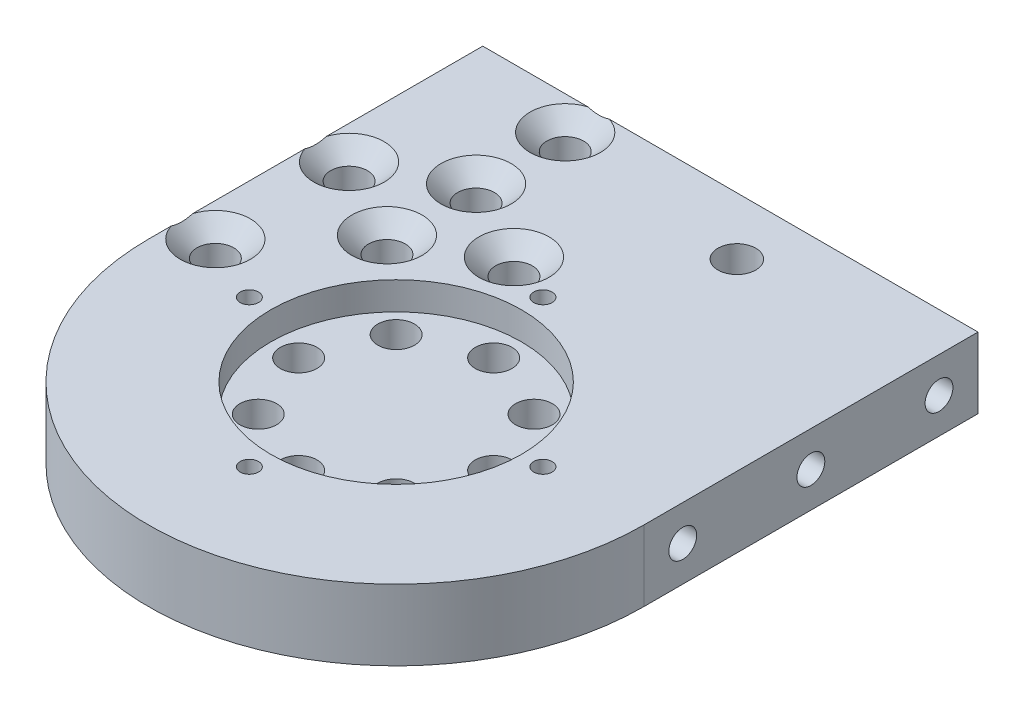
from build123d import *

# Parameters (mm, degrees)
EXTRUDE_1_DEPTH               = 12.7
SKETCH_2_R                    = 22.5
CUT_EXTRUDE_1_DEPTH           = 5
SKETCH_3_R                    = 3.3
CUT_EXTRUDE_2_DEPTH           = 138.376499082
SKETCH_4_R                    = 1.65
CUT_EXTRUDE_3_DEPTH           = 138.747241352
SKETCH_5_R                    = 3.3
CUT_EXTRUDE_4_DEPTH           = 138.747241352
SKETCH_6_R                    = 6.3
CUT_EXTRUDE_5_DEPTH           = 3
CUT_EXTRUDE_5_DRAFT           = -45
CUT_EXTRUDE_5_PROFILE_2_DEPTH = 3
CUT_EXTRUDE_5_PROFILE_2_DRAFT = -45
CUT_EXTRUDE_5_PROFILE_3_DEPTH = 3
CUT_EXTRUDE_5_PROFILE_3_DRAFT = -45
SKETCH_7_R                    = 3.3
CUT_EXTRUDE_6_DEPTH           = 138.747241352
SKETCH_8_R                    = 6.3
CUT_EXTRUDE_7_DEPTH           = 3
CUT_EXTRUDE_7_DRAFT           = -45
CUT_EXTRUDE_7_PROFILE_2_DEPTH = 3
CUT_EXTRUDE_7_PROFILE_2_DRAFT = -45
SKETCH_9_R                    = 3.3
CUT_EXTRUDE_8_DEPTH           = 138.747241352
SKETCH_10_R                   = 6.3
CUT_EXTRUDE_9_DEPTH           = 3
CUT_EXTRUDE_9_DRAFT           = -45
SKETCH_11_R                   = 3.4
CUT_EXTRUDE_10_DEPTH          = 138.747241352
SKETCH_12_R                   = 2.5
CUT_EXTRUDE_11_DEPTH          = 10
SKETCH_13_R                   = 2.5
CUT_EXTRUDE_12_DEPTH          = 15


with BuildPart() as part:
    # 草图1 → 凸台-拉伸1 (new body)
    with BuildSketch(Plane(origin=(0, 0, 0), x_dir=(1, 0, 0), z_dir=(0, 1, 0))):
        with BuildLine():
            Line((0, 0), (88.9, 0))
            Line((88.9, 0), (88.9, -60))
            ThreePointArc((88.9, -60), (44.45, -104.45), (0, -60))
            Line((0, -60), (0, 0))
        make_face()
    extrude(amount=EXTRUDE_1_DEPTH)

    # 草图2 → 切除-拉伸1 (cut)
    with BuildSketch(Plane(origin=(0, 12.7, 0), x_dir=(1, 0, 0), z_dir=(0, 1, 0))):
        with Locations(Location((44.45, -60, 0), (0, 0, 270))):
            Circle(SKETCH_2_R)
    extrude(amount=-CUT_EXTRUDE_1_DEPTH, mode=Mode.SUBTRACT)

    # 草图3 → 切除-拉伸2 (cut, through all)
    with BuildSketch(Plane(origin=(0, 7.7, 0), x_dir=(1, 0, 0), z_dir=(0, 1, 0))):
        with Locations(Location((44.45, -42.5, 0), (0, 0, 270))):
            Circle(SKETCH_3_R)
        with Locations(Location((56.824368671, -47.625631329, 0), (0, 0, 270))):
            Circle(SKETCH_3_R)
        with Locations(Location((61.95, -60, 0), (0, 0, 270))):
            Circle(SKETCH_3_R)
        with Locations(Location((56.824368671, -72.374368671, 0), (0, 0, 270))):
            Circle(SKETCH_3_R)
        with Locations(Location((44.45, -77.5, 0), (0, 0, 270))):
            Circle(SKETCH_3_R)
        with Locations(Location((32.075631329, -72.374368671, 0), (0, 0, 270))):
            Circle(SKETCH_3_R)
        with Locations(Location((26.95, -60, 0), (0, 0, 270))):
            Circle(SKETCH_3_R)
        with Locations(Location((32.075631329, -47.625631329, 0), (0, 0, 270))):
            Circle(SKETCH_3_R)
    extrude(amount=-CUT_EXTRUDE_2_DEPTH, mode=Mode.SUBTRACT)

    # 草图4 → 切除-拉伸3 (cut, through all)
    with BuildSketch(Plane(origin=(0, 12.7, 0), x_dir=(1, 0, 0), z_dir=(0, 1, 0))):
        with Locations(Location((44.45, -33.65, 0), (0, 0, 270))):
            Circle(SKETCH_4_R)
        with Locations(Location((70.8, -60, 0), (0, 0, 270))):
            Circle(SKETCH_4_R)
        with Locations(Location((44.45, -86.35, 0), (0, 0, 270))):
            Circle(SKETCH_4_R)
        with Locations(Location((18.1, -60, 0), (0, 0, 270))):
            Circle(SKETCH_4_R)
    extrude(amount=-CUT_EXTRUDE_3_DEPTH, mode=Mode.SUBTRACT)

    # 草图5 → 切除-拉伸4 (cut, through all)
    with BuildSketch(Plane(origin=(0, 12.7, 0), x_dir=(1, 0, 0), z_dir=(0, 1, 0))):
        with Locations(Location((20.8, -6, 0), (0, 0, 270))):
            Circle(SKETCH_5_R)
        with Locations(Location((20.8, -22, 0), (0, 0, 270))):
            Circle(SKETCH_5_R)
        with Locations(Location((20.8, -38, 0), (0, 0, 270))):
            Circle(SKETCH_5_R)
    extrude(amount=-CUT_EXTRUDE_4_DEPTH, mode=Mode.SUBTRACT)


with BuildPart() as cut_extrude_5_tool:
    # 草图6 → 切除-拉伸5 (with draft: the straight prism first)
    with BuildSketch(Plane(origin=(0, 12.7, 0), x_dir=(1, 0, 0), z_dir=(0, 1, 0))):
        with Locations((20.8, -6)):
            Circle(SKETCH_6_R)
    extrude(amount=-CUT_EXTRUDE_5_DEPTH)
    # 切除-拉伸5: the draft: its side faces are tilted about the plane it starts from
    cut_extrude_5_sides = [cut_extrude_5_tool.faces().sort_by_distance(p)[0] for p in [
        (14.5, 11.2, 6),
    ]]
    draft(cut_extrude_5_sides, Plane(origin=(0, 12.7, 0), x_dir=(1, 0, 0), z_dir=(0, 1, 0)), CUT_EXTRUDE_5_DRAFT)


with BuildPart() as part_1:
    add(part.part)

    # 切除-拉伸5: cut by cut_extrude_5_tool
    add(cut_extrude_5_tool.part, mode=Mode.SUBTRACT)


with BuildPart() as cut_extrude_5_profile_2_tool:
    # 草图6 → 切除-拉伸5 profile 2 (with draft: the straight prism first)
    with BuildSketch(Plane(origin=(0, 12.7, 0), x_dir=(1, 0, 0), z_dir=(0, 1, 0))):
        with Locations((20.8, -22)):
            Circle(SKETCH_6_R)
    extrude(amount=-CUT_EXTRUDE_5_PROFILE_2_DEPTH)
    # 切除-拉伸5 profile 2: the draft: its side faces are tilted about the plane it starts from
    cut_extrude_5_profile_2_sides = [cut_extrude_5_profile_2_tool.faces().sort_by_distance(p)[0] for p in [
        (14.5, 11.2, 22),
    ]]
    draft(cut_extrude_5_profile_2_sides, Plane(origin=(0, 12.7, 0), x_dir=(1, 0, 0), z_dir=(0, 1, 0)), CUT_EXTRUDE_5_PROFILE_2_DRAFT)


with BuildPart() as part_2:
    add(part_1.part)

    # 切除-拉伸5 profile 2: cut by cut_extrude_5_profile_2_tool
    add(cut_extrude_5_profile_2_tool.part, mode=Mode.SUBTRACT)


with BuildPart() as cut_extrude_5_profile_3_tool:
    # 草图6 → 切除-拉伸5 profile 3 (with draft: the straight prism first)
    with BuildSketch(Plane(origin=(0, 12.7, 0), x_dir=(1, 0, 0), z_dir=(0, 1, 0))):
        with Locations((20.8, -38)):
            Circle(SKETCH_6_R)
    extrude(amount=-CUT_EXTRUDE_5_PROFILE_3_DEPTH)
    # 切除-拉伸5 profile 3: the draft: its side faces are tilted about the plane it starts from
    cut_extrude_5_profile_3_sides = [cut_extrude_5_profile_3_tool.faces().sort_by_distance(p)[0] for p in [
        (14.5, 11.2, 38),
    ]]
    draft(cut_extrude_5_profile_3_sides, Plane(origin=(0, 12.7, 0), x_dir=(1, 0, 0), z_dir=(0, 1, 0)), CUT_EXTRUDE_5_PROFILE_3_DRAFT)


with BuildPart() as part_3:
    add(part_2.part)

    # 切除-拉伸5 profile 3: cut by cut_extrude_5_profile_3_tool
    add(cut_extrude_5_profile_3_tool.part, mode=Mode.SUBTRACT)

    # 草图7 → 切除-拉伸6 (cut, through all)
    with BuildSketch(Plane(origin=(0, 12.7, 0), x_dir=(1, 0, 0), z_dir=(0, 1, 0))):
        with Locations(Location((6, -30, 0), (0, 0, 270))):
            Circle(SKETCH_7_R)
        with Locations(Location((6, -54, 0), (0, 0, 270))):
            Circle(SKETCH_7_R)
    extrude(amount=-CUT_EXTRUDE_6_DEPTH, mode=Mode.SUBTRACT)


with BuildPart() as cut_extrude_7_tool:
    # 草图8 → 切除-拉伸7 (with draft: the straight prism first)
    with BuildSketch(Plane(origin=(0, 12.7, 0), x_dir=(1, 0, 0), z_dir=(0, 1, 0))):
        with Locations((6, -30)):
            Circle(SKETCH_8_R)
    extrude(amount=-CUT_EXTRUDE_7_DEPTH)
    # 切除-拉伸7: the draft: its side faces are tilted about the plane it starts from
    cut_extrude_7_sides = [cut_extrude_7_tool.faces().sort_by_distance(p)[0] for p in [
        (-0.3, 11.2, 30),
    ]]
    draft(cut_extrude_7_sides, Plane(origin=(0, 12.7, 0), x_dir=(1, 0, 0), z_dir=(0, 1, 0)), CUT_EXTRUDE_7_DRAFT)


with BuildPart() as part_4:
    add(part_3.part)

    # 切除-拉伸7: cut by cut_extrude_7_tool
    add(cut_extrude_7_tool.part, mode=Mode.SUBTRACT)


with BuildPart() as cut_extrude_7_profile_2_tool:
    # 草图8 → 切除-拉伸7 profile 2 (with draft: the straight prism first)
    with BuildSketch(Plane(origin=(0, 12.7, 0), x_dir=(1, 0, 0), z_dir=(0, 1, 0))):
        with Locations((6, -54)):
            Circle(SKETCH_8_R)
    extrude(amount=-CUT_EXTRUDE_7_PROFILE_2_DEPTH)
    # 切除-拉伸7 profile 2: the draft: its side faces are tilted about the plane it starts from
    cut_extrude_7_profile_2_sides = [cut_extrude_7_profile_2_tool.faces().sort_by_distance(p)[0] for p in [
        (-0.3, 11.2, 54),
    ]]
    draft(cut_extrude_7_profile_2_sides, Plane(origin=(0, 12.7, 0), x_dir=(1, 0, 0), z_dir=(0, 1, 0)), CUT_EXTRUDE_7_PROFILE_2_DRAFT)


with BuildPart() as part_5:
    add(part_4.part)

    # 切除-拉伸7 profile 2: cut by cut_extrude_7_profile_2_tool
    add(cut_extrude_7_profile_2_tool.part, mode=Mode.SUBTRACT)

    # 草图9 → 切除-拉伸8 (cut, through all)
    with BuildSketch(Plane(origin=(0, 12.7, 0), x_dir=(1, 0, 0), z_dir=(0, 1, 0))):
        with Locations(Location((35.6, -30, 0), (0, 0, 270))):
            Circle(SKETCH_9_R)
    extrude(amount=-CUT_EXTRUDE_8_DEPTH, mode=Mode.SUBTRACT)


with BuildPart() as cut_extrude_9_tool:
    # 草图10 → 切除-拉伸9 (with draft: the straight prism first)
    with BuildSketch(Plane(origin=(0, 12.7, 0), x_dir=(1, 0, 0), z_dir=(0, 1, 0))):
        with Locations((35.6, -30)):
            Circle(SKETCH_10_R)
    extrude(amount=-CUT_EXTRUDE_9_DEPTH)
    # 切除-拉伸9: the draft: its side faces are tilted about the plane it starts from
    cut_extrude_9_sides = [cut_extrude_9_tool.faces().sort_by_distance(p)[0] for p in [
        (29.3, 11.2, 30),
    ]]
    draft(cut_extrude_9_sides, Plane(origin=(0, 12.7, 0), x_dir=(1, 0, 0), z_dir=(0, 1, 0)), CUT_EXTRUDE_9_DRAFT)


with BuildPart() as part_6:
    add(part_5.part)

    # 切除-拉伸9: cut by cut_extrude_9_tool
    add(cut_extrude_9_tool.part, mode=Mode.SUBTRACT)

    # 草图11 → 切除-拉伸10 (cut, through all)
    with BuildSketch(Plane(origin=(0, 12.7, 0), x_dir=(1, 0, 0), z_dir=(0, 1, 0))):
        with Locations(Location((55.92, -10.31, 0), (0, 0, 270))):
            Circle(SKETCH_11_R)
    extrude(amount=-CUT_EXTRUDE_10_DEPTH, mode=Mode.SUBTRACT)

    # 草图12 → 切除-拉伸11 (cut)
    with BuildSketch(Plane(origin=(88.9, 0, 0), x_dir=(0, 0, -1), z_dir=(1, 0, 0))):
        with Locations((-7, 6.35)):
            Circle(SKETCH_12_R)
        with Locations((-30, 6.35)):
            Circle(SKETCH_12_R)
        with Locations((-53, 6.35)):
            Circle(SKETCH_12_R)
    extrude(amount=-CUT_EXTRUDE_11_DEPTH, mode=Mode.SUBTRACT)

    # 草图13 → 切除-拉伸12 (cut)
    with BuildSketch(Plane(origin=(0, 0, 0), x_dir=(-1, 0, 0), z_dir=(0, 0, -1))):
        with Locations((-6, 6.35)):
            Circle(SKETCH_13_R)
        with Locations((-35.6, 6.35)):
            Circle(SKETCH_13_R)
    extrude(amount=-CUT_EXTRUDE_12_DEPTH, mode=Mode.SUBTRACT)


solid = part_6.part
